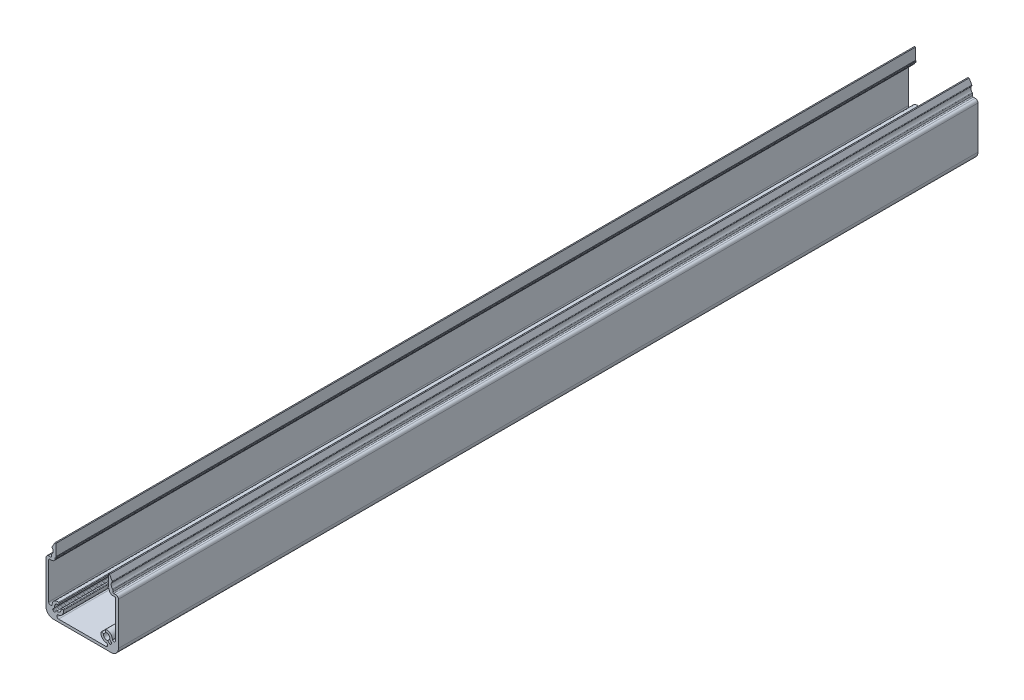
from build123d import *

# Parameters (mm, degrees)
BOSS_EXTRUDE1_DEPTH = 475


with BuildPart() as part:
    # Sketch1 → Boss-Extrude1 (new body)
    with BuildSketch(Plane.XY.offset(20)):
        with BuildLine():
            Line((4, 0), (36, 0))
            ThreePointArc((36, 0), (38.828427125, 1.171572875), (40, 4))
            Line((40, 4), (40, 27.499999994))
            ThreePointArc((40, 27.499999994), (39.56066017, 28.56066017), (38.499999994, 29))
            Line((38.499999994, 29), (37.408493132, 29))
            ThreePointArc((37.408493132, 29), (37.05493974, 29.14644661), (36.90849313, 29.500000002))
            Line((36.90849313, 29.500000002), (36.90849313, 30.572020267))
            ThreePointArc((36.90849313, 30.572020267), (36.86079319, 30.785150869), (36.726794508, 30.957616203))
            ThreePointArc((36.726794508, 30.957616203), (36.005111578, 32.357100716), (36.519951827, 33.845160752))
            ThreePointArc((36.519951827, 33.845160752), (36.647077826, 34.128030253), (36.582952488, 34.431450944))
            Line((36.582952488, 34.431450944), (35.099999998, 37.000000001))
            Line((35.099999998, 37.000000001), (34.500000002, 37.000000001))
            Line((34.500000002, 37.000000001), (34.500000002, 30.672689193))
            Line((34.500000002, 30.672689193), (34.158493132, 30.561067543))
            Line((34.158493132, 30.561067543), (34.158493132, 29.989862813))
            Line((34.158493132, 29.989862813), (34.908493132, 29.989862813))
            Line((34.908493132, 29.989862813), (34.908493132, 29.700000011))
            ThreePointArc((34.908493132, 29.700000011), (35.494279572, 28.285786443), (36.908493141, 27.700000003))
            Line((36.908493141, 27.700000003), (38.000000017, 27.700000003))
            ThreePointArc((38.000000017, 27.700000003), (38.353553409, 27.553553393), (38.500000019, 27.200000001))
            Line((38.500000019, 27.200000001), (38.500000019, 6.9547727))
            ThreePointArc((38.500000019, 6.9547727), (37.882683451, 6.030893167), (36.792893237, 6.247665919))
            Line((36.792893237, 6.247665919), (36.648161659, 6.392397496))
            ThreePointArc((36.648161659, 6.392397496), (35.587251229, 8.859212237), (33.009530056, 9.611581471))
            ThreePointArc((33.009530056, 9.611581471), (32.804700675, 9.478725012), (32.766463725, 9.237594653))
            Line((32.766463725, 9.237594653), (33.047066675, 8.190370192))
            ThreePointArc((33.047066675, 8.190370192), (34.786339421, 7.686520507), (35.148364083, 5.912296075))
            Line((35.148364083, 5.912296075), (36.146446608, 4.91421355))
            ThreePointArc((36.146446608, 4.91421355), (36.292893217, 4.560660161), (36.146446608, 4.207106773))
            Line((36.146446608, 4.207106773), (35.792893214, 3.853553379))
            ThreePointArc((35.792893214, 3.853553379), (35.439339826, 3.70710677), (35.085786437, 3.853553379))
            Line((35.085786437, 3.853553379), (34.087703906, 4.85163591))
            ThreePointArc((34.087703906, 4.85163591), (32.313479487, 5.213660585), (31.809629807, 6.952933321))
            Line((31.809629807, 6.952933321), (30.762405333, 7.233536272))
            ThreePointArc((30.762405333, 7.233536272), (30.521274984, 7.195299323), (30.38841853, 6.990469949))
            ThreePointArc((30.38841853, 6.990469949), (31.140787752, 4.412748784), (33.607602477, 3.351838341))
            Line((33.607602477, 3.351838341), (33.752334032, 3.207106785))
            ThreePointArc((33.752334032, 3.207106785), (33.969106782, 2.117316579), (33.045227255, 1.500000015))
            Line((33.045227255, 1.500000015), (6.954772716, 1.500000015))
            ThreePointArc((6.954772716, 1.500000015), (6.030893183, 2.117316583), (6.247665934, 3.207106797))
            Line((6.247665934, 3.207106797), (6.392397512, 3.351838375))
            ThreePointArc((6.392397512, 3.351838375), (8.859212224, 4.412748803), (9.611581449, 6.990469949))
            ThreePointArc((9.611581449, 6.990469949), (9.478724996, 7.195299323), (9.237594646, 7.233536272))
            Line((9.237594646, 7.233536272), (8.190370187, 6.952933328))
            ThreePointArc((8.190370187, 6.952933328), (7.686520502, 5.213660596), (5.912296085, 4.851635932))
            Line((5.912296085, 4.851635932), (4.914213553, 3.8535534))
            ThreePointArc((4.914213553, 3.8535534), (4.560660164, 3.707106791), (4.207106776, 3.8535534))
            Line((4.207106776, 3.8535534), (3.853553388, 4.207106787))
            ThreePointArc((3.853553388, 4.207106787), (3.70710678, 4.560660175), (3.853553388, 4.914213564))
            Line((3.853553388, 4.914213564), (4.85163592, 5.912296095))
            ThreePointArc((4.85163592, 5.912296095), (5.213660585, 7.686520517), (6.952933322, 8.190370198))
            Line((6.952933322, 8.190370198), (7.233536268, 9.237594644))
            ThreePointArc((7.233536268, 9.237594644), (7.195299318, 9.478725003), (6.990469936, 9.611581462))
            ThreePointArc((6.990469936, 9.611581462), (4.412748785, 8.859212233), (3.351838362, 6.392397513))
            Line((3.351838362, 6.392397513), (3.207106785, 6.247665935))
            ThreePointArc((3.207106785, 6.247665935), (2.11731657, 6.030893183), (1.500000002, 6.954772717))
            Line((1.500000002, 6.954772717), (1.500000002, 27.200000001))
            ThreePointArc((1.500000002, 27.200000001), (1.646446612, 27.553553393), (2.000000004, 27.700000003))
            Line((2.000000004, 27.700000003), (3.091506864, 27.700000003))
            ThreePointArc((3.091506864, 27.700000003), (4.505720432, 28.285786443), (5.091506872, 29.700000011))
            Line((5.091506872, 29.700000011), (5.091506872, 29.989862813))
            Line((5.091506872, 29.989862813), (5.841506868, 29.989862813))
            Line((5.841506868, 29.989862813), (5.841506868, 30.561067541))
            Line((5.841506868, 30.561067541), (5.499999998, 30.672689191))
            Line((5.499999998, 30.672689191), (5.499999998, 37.000000001))
            Line((5.499999998, 37.000000001), (4.899999998, 37.000000001))
            Line((4.899999998, 37.000000001), (3.417047508, 34.431450944))
            ThreePointArc((3.417047508, 34.431450944), (3.35292217, 34.128030253), (3.480048169, 33.845160751))
            ThreePointArc((3.480048169, 33.845160751), (3.99488842, 32.357100716), (3.273205491, 30.957616203))
            ThreePointArc((3.273205491, 30.957616203), (3.13920681, 30.785150869), (3.09150687, 30.572020267))
            Line((3.09150687, 30.572020267), (3.09150687, 29.500000002))
            ThreePointArc((3.09150687, 29.500000002), (2.94506026, 29.14644661), (2.591506868, 29))
            Line((2.591506868, 29), (1.500000006, 29))
            ThreePointArc((1.500000006, 29), (0.43933983, 28.56066017), (0, 27.499999994))
            Line((0, 27.499999994), (0, 4))
            ThreePointArc((0, 4), (1.171572875, 1.171572875), (4, 0))
        make_face()
    extrude(amount=-BOSS_EXTRUDE1_DEPTH)


solid = part.part
